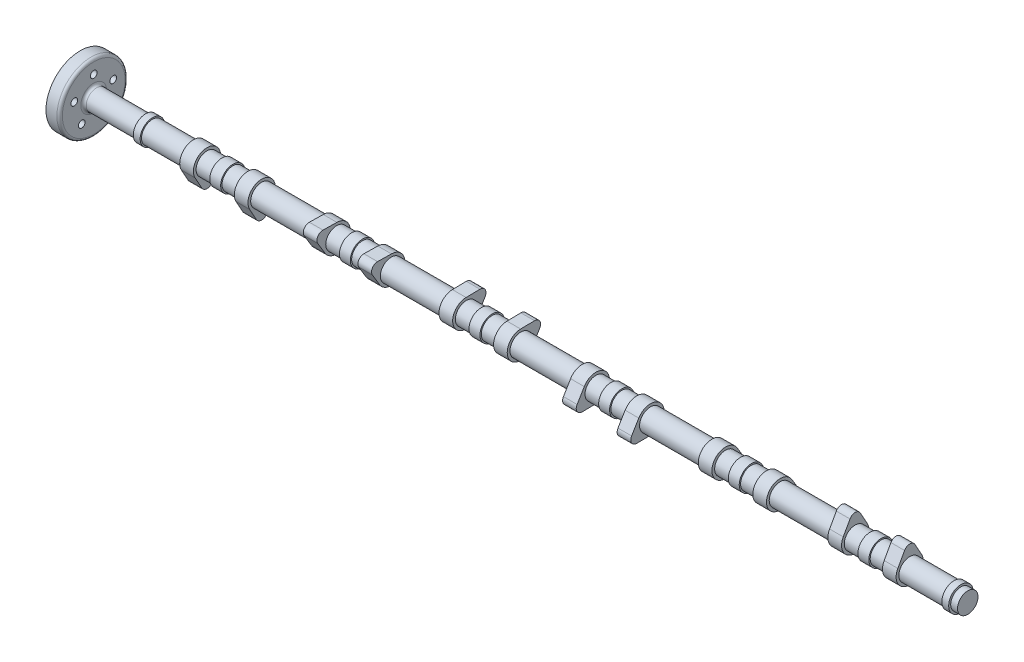
from build123d import *

# Parameters (mm, degrees)
SKETCH1_R             = 8
BOSS_EXTRUDE1_DEPTH   = 47.5
BOSS_EXTRUDE2_START   = 15
BOSS_EXTRUDE2_DEPTH   = 10
SKETCH3_R             = 9
BOSS_EXTRUDE3_DEPTH   = 4
LPATTERN1_COUNT       = 6
LPATTERN1_PITCH       = 95
BODY_MOVE_COPY1_ANGLE = 60
BODY_MOVE_COPY2_ANGLE = 120
BODY_MOVE_COPY3_ANGLE = 60
BODY_MOVE_COPY4_ANGLE = 120
BODY_MOVE_COPY5_ANGLE = 180
BOSS_EXTRUDE4_START   = 10
SKETCH4_R             = 8
BOSS_EXTRUDE4_DEPTH   = 10
BOSS_EXTRUDE5_START   = 5
SKETCH5_R             = 9
BOSS_EXTRUDE5_DEPTH   = 5
SKETCH6_R             = 7.5
BOSS_EXTRUDE6_DEPTH   = 5
SKETCH7_R             = 8
BOSS_EXTRUDE7_DEPTH   = 7.5
SKETCH8_R             = 9
BOSS_EXTRUDE8_DEPTH   = 5
BOSS_EXTRUDE9_START   = 38
SKETCH9_R             = 7.5
BOSS_EXTRUDE9_DEPTH   = 38
SKETCH10_R            = 25
SKETCH10_R_2          = 2.5
BOSS_EXTRUDE10_DEPTH  = 10
FILLET1_R             = 2
SKETCH11_R            = 2.5
CUT_EXTRUDE1_DEPTH    = 10


with BuildPart() as part:
    # Sketch1 → Boss-Extrude1 (new, symmetric)
    with BuildSketch(Plane(origin=(0, 0, 0), x_dir=(0, 0, -1), z_dir=(1, 0, 0))):
        Circle(SKETCH1_R)
    extrude(amount=BOSS_EXTRUDE1_DEPTH, both=True)

    # Sketch2 → Boss-Extrude2 (add)
    with BuildSketch(Plane(origin=(0, 0, 0), x_dir=(0, 0, -1), z_dir=(1, 0, 0)).offset(BOSS_EXTRUDE2_START)):
        with BuildLine():
            Line((-8.746197071, -4.848096202), (-3.807936598, -13.756953924))
            ThreePointArc((-3.807936598, -13.756953924), (0, -16), (3.807936598, -13.756953924))
            Line((3.807936598, -13.756953924), (8.746197071, -4.848096202))
            ThreePointArc((8.746197071, -4.848096202), (0, 10), (-8.746197071, -4.848096202))
        make_face()
    boss_extrude2 = extrude(amount=BOSS_EXTRUDE2_DEPTH)

    # Mirror1: Boss-Extrude2 across plane
    add(boss_extrude2.mirror(Plane(origin=(0, 0, 0), x_dir=(0, 0, 1), z_dir=(1, 0, 0))))

    # Sketch3 → Boss-Extrude3 (add, symmetric)
    with BuildSketch(Plane(origin=(0, 0, 0), x_dir=(0, 0, -1), z_dir=(1, 0, 0))):
        Circle(SKETCH3_R)
    extrude(amount=BOSS_EXTRUDE3_DEPTH, both=True)


with BuildPart() as lpattern1_1:
    # LPattern1: pattern copy
    add(part.part.moved(Location(Vector(1, 0, 0) * (1 * LPATTERN1_PITCH))))


with BuildPart() as lpattern1_2:
    # LPattern1: pattern copy
    add(part.part.moved(Location(Vector(1, 0, 0) * (2 * LPATTERN1_PITCH))))


with BuildPart() as lpattern1_3:
    # LPattern1: pattern copy
    add(part.part.moved(Location(Vector(1, 0, 0) * (3 * LPATTERN1_PITCH))))


with BuildPart() as lpattern1_4:
    # LPattern1: pattern copy
    add(part.part.moved(Location(Vector(1, 0, 0) * (4 * LPATTERN1_PITCH))))


with BuildPart() as lpattern1_5:
    # LPattern1: pattern copy
    add(part.part.moved(Location(Vector(1, 0, 0) * (5 * LPATTERN1_PITCH))))


with BuildPart() as lpattern1_3_1:
    # Body-Move/Copy1: moved
    add(lpattern1_3.part.rotate(Axis((0, 0, 0), (-1, 0, 0)), BODY_MOVE_COPY1_ANGLE))


with BuildPart() as lpattern1_1_1:
    # Body-Move/Copy2: moved
    add(lpattern1_1.part.rotate(Axis((0, 0, 0), (-1, 0, 0)), BODY_MOVE_COPY2_ANGLE))


with BuildPart() as lpattern1_4_1:
    # Body-Move/Copy3: moved
    add(lpattern1_4.part.rotate(Axis((0, 0, 0), (1, 0, 0)), BODY_MOVE_COPY3_ANGLE))


with BuildPart() as lpattern1_2_1:
    # Body-Move/Copy4: moved
    add(lpattern1_2.part.rotate(Axis((0, 0, 0), (1, 0, 0)), BODY_MOVE_COPY4_ANGLE))


with BuildPart() as lpattern1_5_1:
    # Body-Move/Copy5: moved
    add(lpattern1_5.part.rotate(Axis((0, 0, 0), (1, 0, 0)), BODY_MOVE_COPY5_ANGLE))

    # Sketch4 → Boss-Extrude4 (add)
    with BuildSketch(Plane(origin=(522.5, 0, 0), x_dir=(0, 0, -1), z_dir=(1, 0, 0)).offset(BOSS_EXTRUDE4_START)):
        Circle(SKETCH4_R)
    extrude(amount=-BOSS_EXTRUDE4_DEPTH)

    # Sketch5 → Boss-Extrude5 (add)
    with BuildSketch(Plane(origin=(532.5, 0, 0), x_dir=(0, 0, -1), z_dir=(1, 0, 0)).offset(BOSS_EXTRUDE5_START)):
        Circle(SKETCH5_R)
    extrude(amount=-BOSS_EXTRUDE5_DEPTH)


with BuildPart() as part_1:
    add(part.part)

    # Combine1: union LPattern1_1, LPattern1_2, LPattern1_3, LPattern1_4, LPattern1_5
    add(lpattern1_1_1.part)
    add(lpattern1_2_1.part)
    add(lpattern1_3_1.part)
    add(lpattern1_4_1.part)
    add(lpattern1_5_1.part)

    # Sketch6 → Boss-Extrude6 (add)
    with BuildSketch(Plane(origin=(537.5, 0, 0), x_dir=(0, 0, -1), z_dir=(1, 0, 0))):
        Circle(SKETCH6_R)
    extrude(amount=BOSS_EXTRUDE6_DEPTH)

    # Sketch7 → Boss-Extrude7 (add)
    with BuildSketch(Plane.ZY.offset(47.5)):
        Circle(SKETCH7_R)
    extrude(amount=BOSS_EXTRUDE7_DEPTH)

    # Sketch8 → Boss-Extrude8 (add)
    with BuildSketch(Plane.ZY.offset(55)):
        Circle(SKETCH8_R)
    extrude(amount=BOSS_EXTRUDE8_DEPTH)

    # Sketch9 → Boss-Extrude9 (add)
    with BuildSketch(Plane.ZY.offset(60).offset(BOSS_EXTRUDE9_START)):
        Circle(SKETCH9_R)
    extrude(amount=-BOSS_EXTRUDE9_DEPTH)

    # Sketch10 → Boss-Extrude10 (add)
    with BuildSketch(Plane.ZY.offset(98)):
        Circle(SKETCH10_R)
        Circle(SKETCH10_R_2, mode=Mode.SUBTRACT)
    extrude(amount=BOSS_EXTRUDE10_DEPTH)

    # Fillet1
    fillet1_edges = [part_1.edges().sort_by_distance(p)[0] for p in [
        (-98, 0, -25),
        (-98, 0, -7.5),
    ]]
    fillet(fillet1_edges, radius=FILLET1_R)

    # Sketch11 → Cut-Extrude1 (cut)
    with BuildSketch(Plane.ZY.offset(108)):
        with Locations((0, 15)):
            Circle(SKETCH11_R)
        with Locations((-14.265847744, 4.635254916)):
            Circle(SKETCH11_R)
        with Locations((-8.816778784, -12.135254916)):
            Circle(SKETCH11_R)
        with Locations((8.816778784, -12.135254916)):
            Circle(SKETCH11_R)
        with Locations((14.265847744, 4.635254916)):
            Circle(SKETCH11_R)
    extrude(amount=-CUT_EXTRUDE1_DEPTH, mode=Mode.SUBTRACT)


solid = part_1.part
